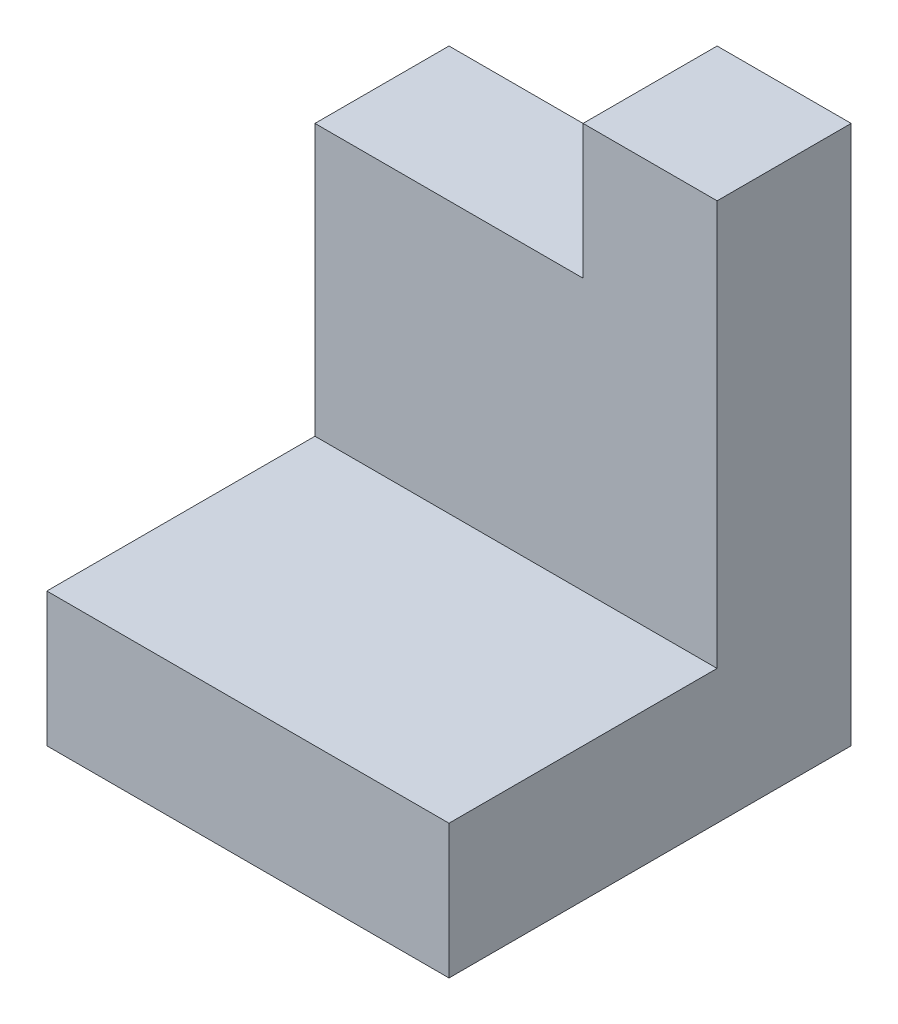
from build123d import *

# Parameters (mm, degrees)
ESBO_O1_W                = 60
ESBO_O1_H                = 20
RESSALTO_EXTRUS_O1_DEPTH = 40
ESBO_O2_W                = 60
ESBO_O2_H                = 60.417785093
RESSALTO_EXTRUS_O2_DEPTH = 20
ESBO_O3_W                = 20
ESBO_O3_H                = 20
RESSALTO_EXTRUS_O3_DEPTH = 20


with BuildPart() as part:
    # Esboço1 → Ressalto-extrusão1 (new body)
    with BuildSketch(Plane.XY):
        with Locations((30, 10)):
            Rectangle(ESBO_O1_W, ESBO_O1_H)
    extrude(amount=RESSALTO_EXTRUS_O1_DEPTH)

    # Esboço2 → Ressalto-extrusão2 (add)
    with BuildSketch(Plane(origin=(0, 0, 0), x_dir=(-1, 0, 0), z_dir=(0, 0, -1))):
        with Locations((-30, 30.208892547)):
            Rectangle(ESBO_O2_W, ESBO_O2_H)
    extrude(amount=RESSALTO_EXTRUS_O2_DEPTH)

    # Esboço3 → Ressalto-extrusão3 (add)
    with BuildSketch(Plane(origin=(0, 60.417785093, 0), x_dir=(1, 0, 0), z_dir=(0, 1, 0))):
        with Locations((50, 10)):
            Rectangle(ESBO_O3_W, ESBO_O3_H)
    extrude(amount=RESSALTO_EXTRUS_O3_DEPTH)


solid = part.part
